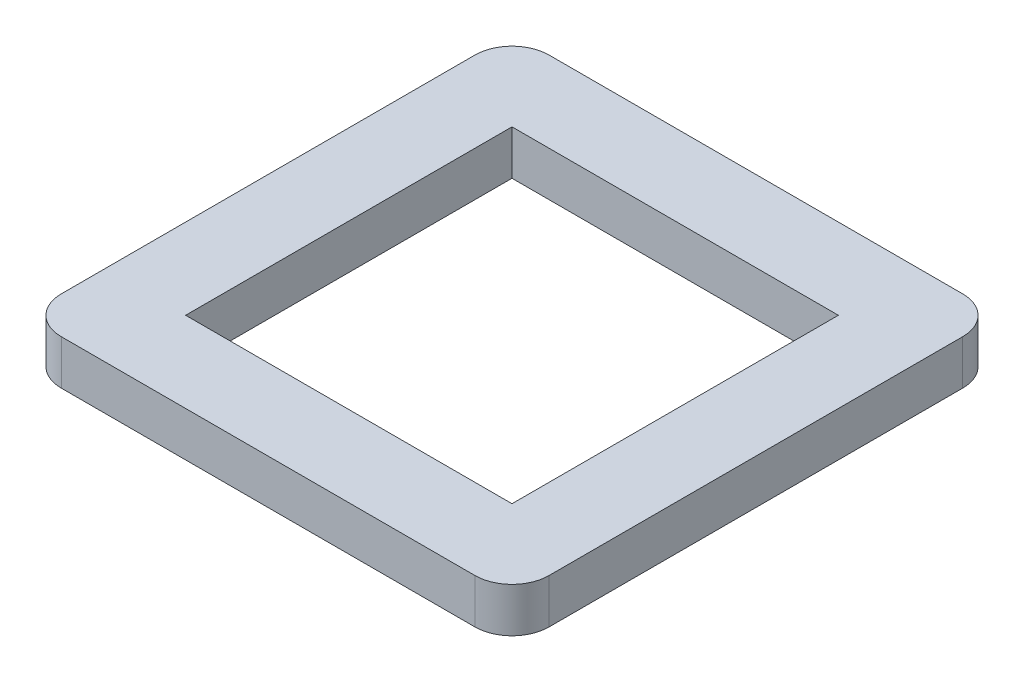
from build123d import *

# Parameters (mm, degrees)
SKETCH1_W           = 139
SKETCH1_H           = 139
BOSS_EXTRUDE1_DEPTH = 6.35
FILLET1_R           = 10.56
SKETCH2_W           = 93
SKETCH2_H           = 93
SLOTCUT_DEPTH       = 100.104944377


with BuildPart() as part:
    # Sketch1 → Boss-Extrude1 (new, symmetric)
    with BuildSketch(Plane(origin=(0, 0, 0), x_dir=(1, 0, 0), z_dir=(0, 1, 0))):
        Rectangle(SKETCH1_W, SKETCH1_H)
    extrude(amount=BOSS_EXTRUDE1_DEPTH, both=True)

    # Fillet1
    fillet1_edges = [part.edges().sort_by_distance(p)[0] for p in [
        (69.5, 0, 69.5),
        (-69.5, 0, 69.5),
        (-69.5, 0, -69.5),
        (69.5, 0, -69.5),
    ]]
    fillet(fillet1_edges, radius=FILLET1_R)

    # Sketch2 → SlotCut (cut, through all)
    with BuildSketch(Plane(origin=(0, 6.35, 0), x_dir=(1, 0, 0), z_dir=(0, 1, 0))):
        Rectangle(SKETCH2_W, SKETCH2_H)
    extrude(amount=-SLOTCUT_DEPTH, mode=Mode.SUBTRACT)


solid = part.part
